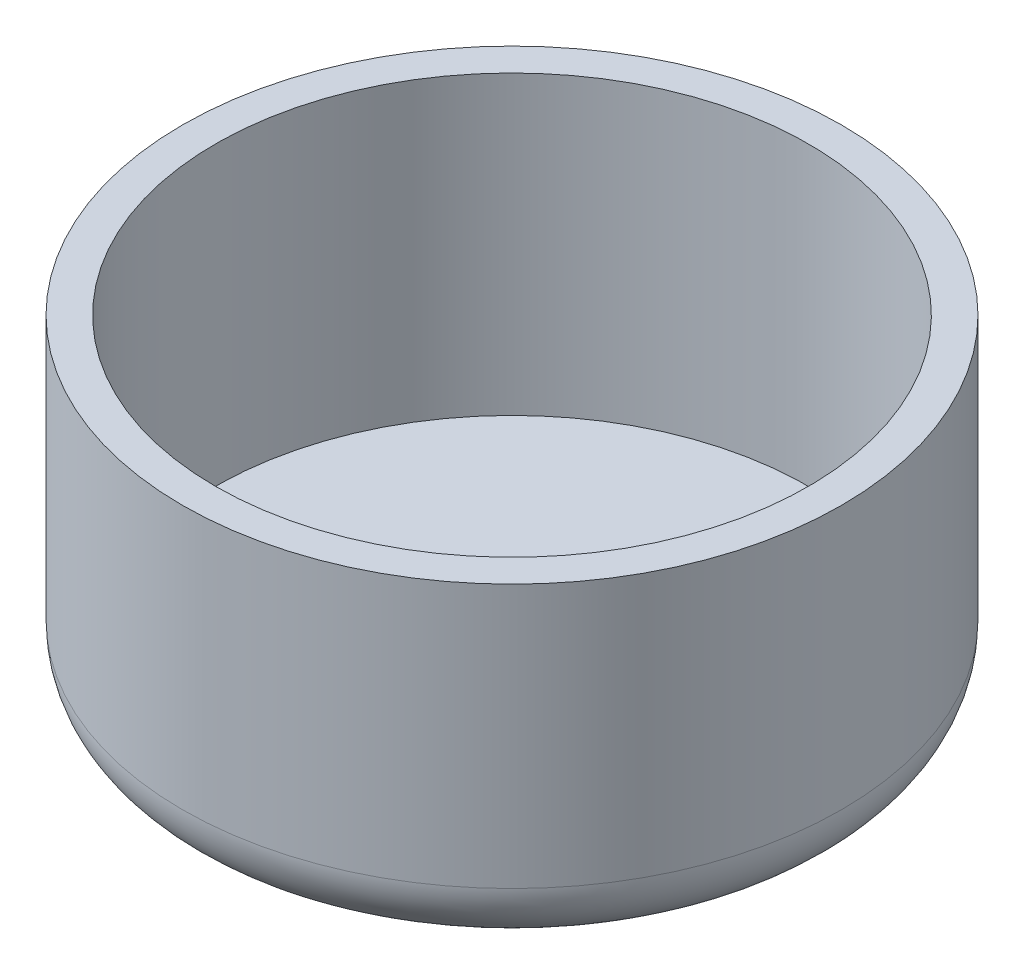
from build123d import *

# Parameters (mm, degrees)
SKETCH2_R           = 100
BOSS_EXTRUDE1_DEPTH = 100
SKETCH3_R           = 90
CUT_EXTRUDE1_DEPTH  = 90
FILLET1_R           = 20
SKETCH4_R           = 4
BOSS_EXTRUDE2_DEPTH = 3


with BuildPart() as part:
    # Sketch2 → Boss-Extrude1 (new body)
    with BuildSketch(Plane(origin=(0, 0, 0), x_dir=(1, 0, 0), z_dir=(0, 1, 0))):
        with Locations(Location((0, 0, 0), (0, 0, 270))):
            Circle(SKETCH2_R)
    extrude(amount=BOSS_EXTRUDE1_DEPTH)

    # Sketch3 → Cut-Extrude1 (cut)
    with BuildSketch(Plane(origin=(0, 100, 0), x_dir=(1, 0, 0), z_dir=(0, 1, 0))):
        with Locations(Location((0, 0, 0), (0, 0, 270))):
            Circle(SKETCH3_R)
    extrude(amount=-CUT_EXTRUDE1_DEPTH, mode=Mode.SUBTRACT)

    # Fillet1
    fillet1_edges = [part.edges().sort_by_distance(p)[0] for p in [
        (0, 0, -100),
    ]]
    fillet(fillet1_edges, radius=FILLET1_R)

    # Sketch4 → Boss-Extrude2 (add)
    with BuildSketch(Plane.XZ):
        with Locations(Location((0, 0, 0), (0, 0, 90))):
            Circle(SKETCH4_R)
    extrude(amount=BOSS_EXTRUDE2_DEPTH)


solid = part.part
